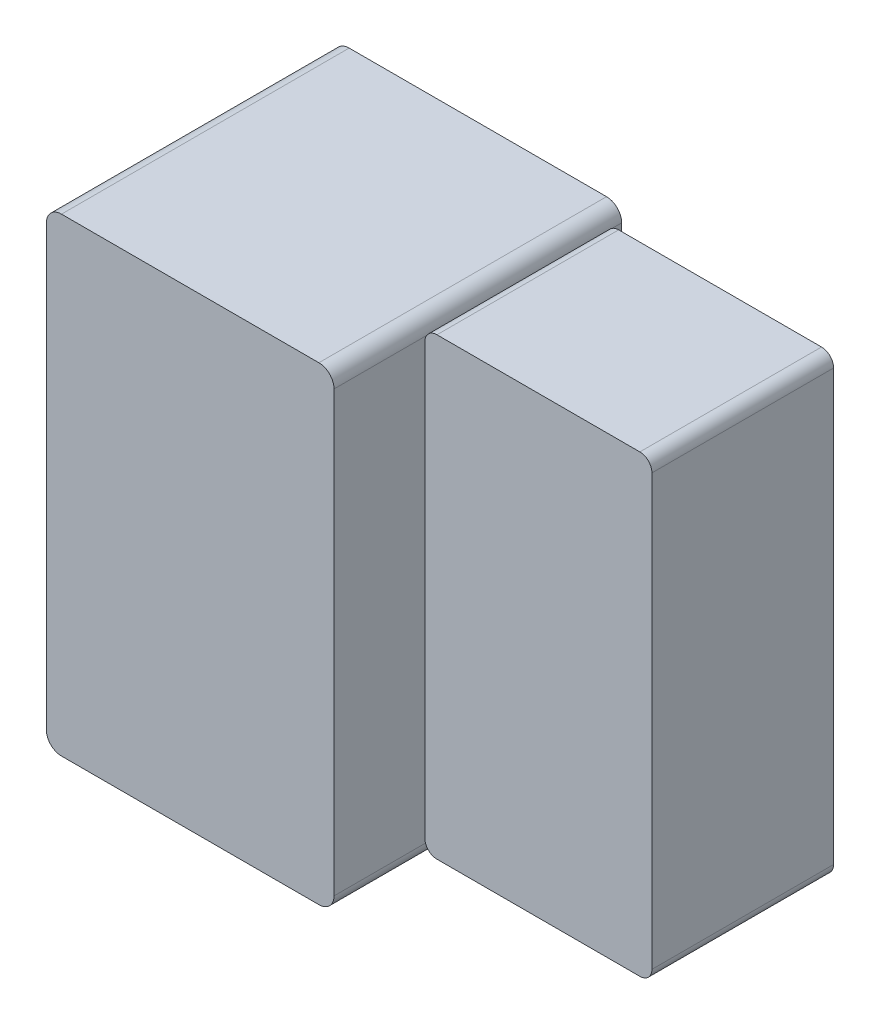
from build123d import *

# Parameters (mm, degrees)
HEADER_BUDGET_9P5X15P5_H9P5_PLUSX_DEPTH = 9.5
MATED_PLUG_BUDGET_OUTWARD_PLUSX_DEPTH   = 6


with BuildPart() as part:
    # 草图1 → Header_budget_9p5x15p5_H9p5_plusX (new body)
    with BuildSketch(Plane.XY):
        with BuildLine():
            Line((4.5, -7.75), (13, -7.75))
            ThreePointArc((13, -7.75), (13.353553391, -7.603553391), (13.5, -7.25))
            Line((13.5, -7.25), (13.5, 7.25))
            ThreePointArc((13.5, 7.25), (13.353553391, 7.603553391), (13, 7.75))
            Line((13, 7.75), (4.5, 7.75))
            ThreePointArc((4.5, 7.75), (4.146446609, 7.603553391), (4, 7.25))
            Line((4, 7.25), (4, -7.25))
            ThreePointArc((4, -7.25), (4.146446609, -7.603553391), (4.5, -7.75))
        make_face()
    extrude(amount=HEADER_BUDGET_9P5X15P5_H9P5_PLUSX_DEPTH)

    # 草图2 → Mated_plug_budget_outward_plusX (add)
    with BuildSketch(Plane.XY.offset(0.5)):
        with BuildLine():
            Line((13.9, -7.5), (20.6, -7.5))
            ThreePointArc((20.6, -7.5), (20.882842712, -7.382842712), (21, -7.1))
            Line((21, -7.1), (21, 7.1))
            ThreePointArc((21, 7.1), (20.882842712, 7.382842712), (20.6, 7.5))
            Line((20.6, 7.5), (13.9, 7.5))
            ThreePointArc((13.9, 7.5), (13.617157288, 7.382842712), (13.5, 7.1))
            Line((13.5, 7.1), (13.5, -7.1))
            ThreePointArc((13.5, -7.1), (13.617157288, -7.382842712), (13.9, -7.5))
        make_face()
    extrude(amount=MATED_PLUG_BUDGET_OUTWARD_PLUSX_DEPTH)


solid = part.part
